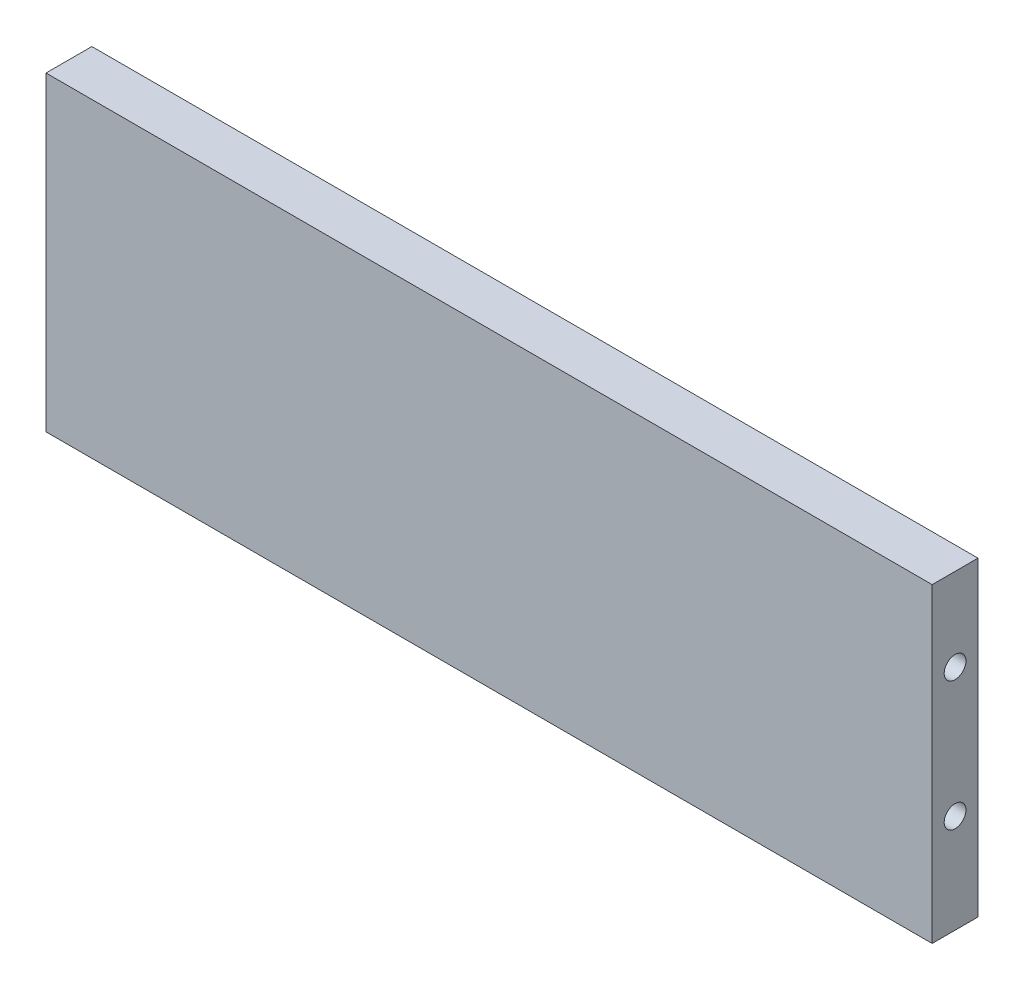
from build123d import *

# Parameters (mm, degrees)
SKETCH1_W           = 92.0496
SKETCH1_H           = 32.2834
BOSS_EXTRUDE1_DEPTH = 4.7625
SKETCH2_R           = 1.1303
CUT_EXTRUDE1_DEPTH  = 19.05
SKETCH3_R           = 1.1303
CUT_EXTRUDE2_DEPTH  = 94.57544948


with BuildPart() as part:
    # Sketch1 → Boss-Extrude1 (new body)
    with BuildSketch(Plane.XY):
        Rectangle(SKETCH1_W, SKETCH1_H)
    extrude(amount=BOSS_EXTRUDE1_DEPTH)

    # Sketch2 → Cut-Extrude1 (cut)
    with BuildSketch(Plane.XZ.offset(16.1417)):
        with Locations(Location((-20.6248, 2.38125, 0), (0, 0, 270))):
            Circle(SKETCH2_R)
        with Locations(Location((20.6248, 2.38125, 0), (0, 0, 270))):
            Circle(SKETCH2_R)
    extrude(amount=-CUT_EXTRUDE1_DEPTH, mode=Mode.SUBTRACT)

    # Sketch3 → Cut-Extrude2 (cut, through all)
    with BuildSketch(Plane.ZY.offset(46.0248)):
        with Locations((2.38125, 7.5311)):
            Circle(SKETCH3_R)
        with Locations((2.38125, -5.8801)):
            Circle(SKETCH3_R)
    extrude(amount=-CUT_EXTRUDE2_DEPTH, mode=Mode.SUBTRACT)


solid = part.part
